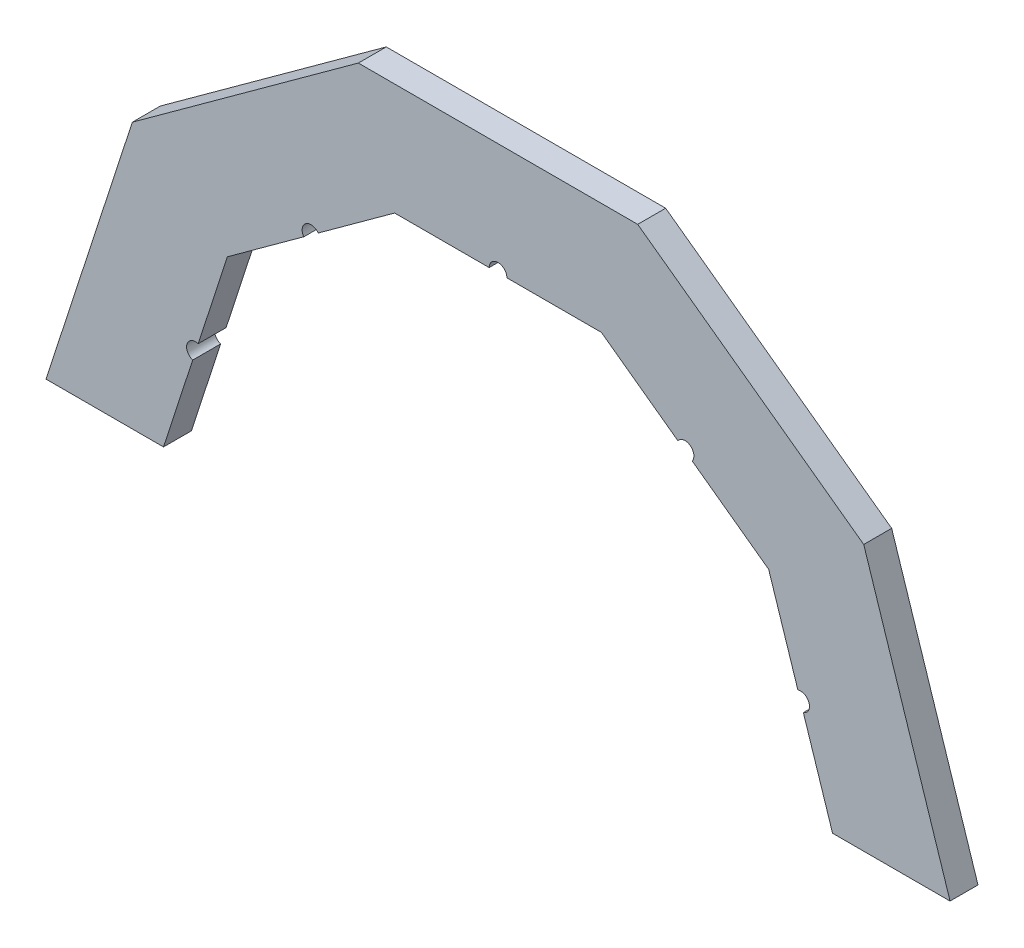
from build123d import *

# Parameters (mm, degrees)
BOSS_EXTRUDE1_DEPTH = 10


with BuildPart() as part:
    # Sketch1 → Boss-Extrude1 (new body)
    with BuildSketch(Plane.XY):
        with BuildLine():
            Line((-96.875667103, 70.38429208), (-107.329159547, 38.211750479))
            ThreePointArc((-107.329159547, 38.211750479), (-111.329892944, 36.173274997), (-109.291417462, 32.172541601))
            Line((-109.291417462, 32.172541601), (-119.744909905, 0))
            Line((-119.744909905, 0), (-161.803398875, 0))
            Line((-161.803398875, 0), (-130.901699437, 95.10565163))
            Line((-130.901699437, 95.10565163), (-50, 153.884176859))
            Line((-50, 153.884176859), (50, 153.884176859))
            Line((50, 153.884176859), (130.901699437, 95.10565163))
            Line((130.901699437, 95.10565163), (161.803398875, 0))
            Line((161.803398875, 0), (119.744909905, 0))
            Line((119.744909905, 0), (109.291417462, 32.172541601))
            ThreePointArc((109.291417462, 32.172541601), (111.329892944, 36.173274997), (107.329159547, 38.211750479))
            Line((107.329159547, 38.211750479), (96.875667103, 70.38429208))
            Line((96.875667103, 70.38429208), (69.508068584, 90.268016293))
            ThreePointArc((69.508068584, 90.268016293), (68.805657803, 94.702863426), (64.37081067, 94.000452645))
            Line((64.37081067, 94.000452645), (37.003212151, 113.884176859))
            Line((37.003212151, 113.884176859), (3.175, 113.884176859))
            ThreePointArc((3.175, 113.884176859), (0, 117.059176859), (-3.175, 113.884176859))
            Line((-3.175, 113.884176859), (-37.003212151, 113.884176859))
            Line((-37.003212151, 113.884176859), (-64.37081067, 94.000452645))
            ThreePointArc((-64.37081067, 94.000452645), (-68.805657803, 94.702863426), (-69.508068584, 90.268016293))
            Line((-69.508068584, 90.268016293), (-96.875667103, 70.38429208))
        make_face()
    extrude(amount=BOSS_EXTRUDE1_DEPTH)


solid = part.part
